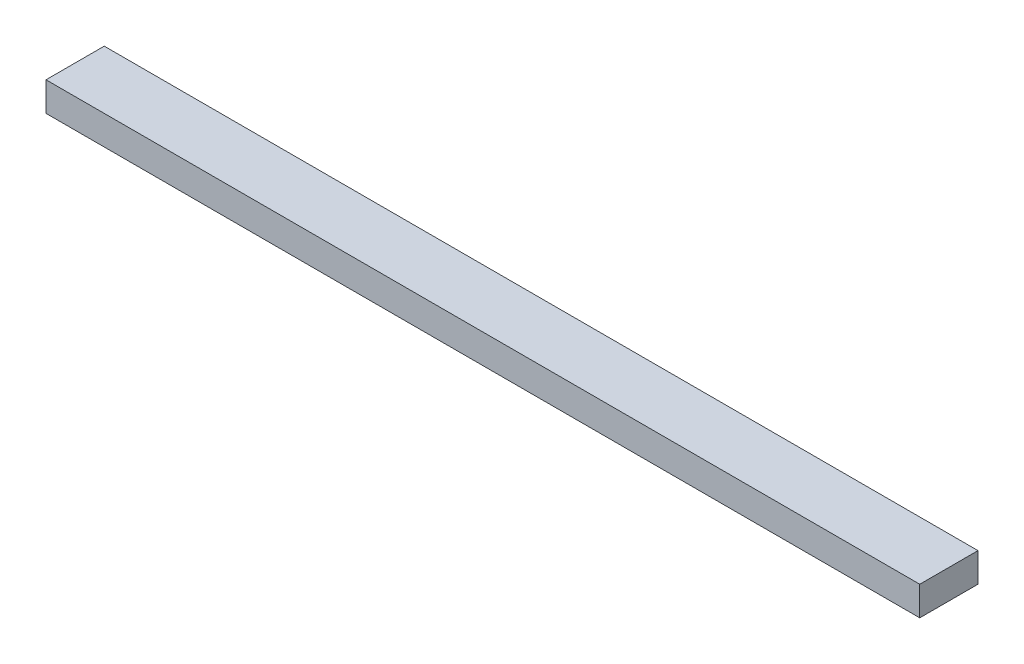
from build123d import *

# Parameters (mm, degrees)
SKETCH2_W           = 300
SKETCH2_H           = 20
BOSS_EXTRUDE1_DEPTH = 10


with BuildPart() as part:
    # Sketch2 → Boss-Extrude1 (new body)
    with BuildSketch(Plane(origin=(0, 0, 0), x_dir=(1, 0, 0), z_dir=(0, 1, 0))):
        Rectangle(SKETCH2_W, SKETCH2_H)
    extrude(amount=BOSS_EXTRUDE1_DEPTH)


solid = part.part
